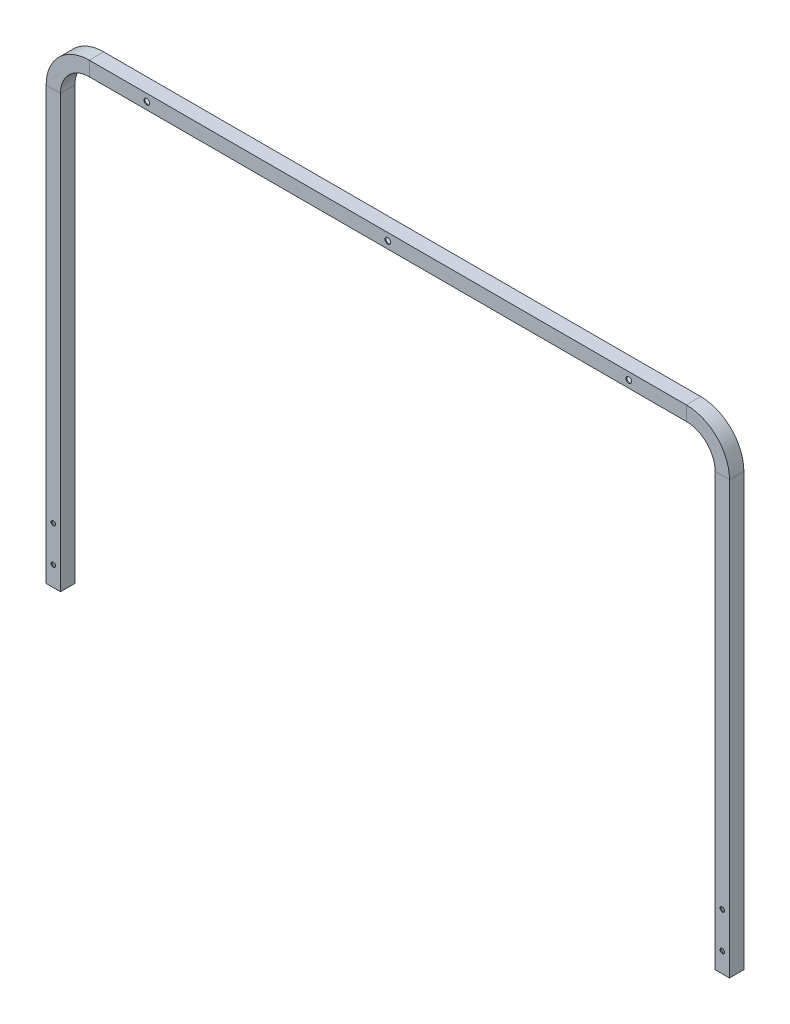
from build123d import *

# Parameters (mm, degrees)
SKETCH15_W                                    = 20
SKETCH15_H                                    = 20
SKETCH15_W_2                                  = 17.6
SKETCH15_H_2                                  = 17.6
AL_TUBE_SQUARE_AL_TUBE_0_75_SQR_X_0_065_DEPTH = 600
SKETCH15_ON_SEGMENT_2_W                       = 20
SKETCH15_ON_SEGMENT_2_H                       = 20
SKETCH15_ON_SEGMENT_2_W_2                     = 17.6
SKETCH15_ON_SEGMENT_2_H_2                     = 17.6
AL_TUBE_SQUARE_AL_TUBE_0_75_SQR_X_0_2_ANGLE   = 90
SKETCH15_ON_SEGMENT_3_W                       = 20
SKETCH15_ON_SEGMENT_3_H                       = 20
SKETCH15_ON_SEGMENT_3_W_2                     = 17.6
SKETCH15_ON_SEGMENT_3_H_2                     = 17.6
AL_TUBE_SQUARE_AL_TUBE_0_75_SQR_X_0_3_DEPTH   = 830
SKETCH15_ON_SEGMENT_4_W                       = 20
SKETCH15_ON_SEGMENT_4_H                       = 20
SKETCH15_ON_SEGMENT_4_W_2                     = 17.6
SKETCH15_ON_SEGMENT_4_H_2                     = 17.6
AL_TUBE_SQUARE_AL_TUBE_0_75_SQR_X_0_4_ANGLE   = 90
SKETCH15_ON_SEGMENT_5_W                       = 20
SKETCH15_ON_SEGMENT_5_H                       = 20
SKETCH15_ON_SEGMENT_5_W_2                     = 17.6
SKETCH15_ON_SEGMENT_5_H_2                     = 17.6
AL_TUBE_SQUARE_AL_TUBE_0_75_SQR_X_0_5_DEPTH   = 600
SKETCH16_R                                    = 4
CUT_EXTRUDE1_DEPTH                            = 1149.738438462
SKETCH17_R                                    = 3.125
CUT_EXTRUDE2_DEPTH                            = 1149.738438462


with BuildPart() as part:
    # Sketch15 → Al tube square AL TUBE 0.75 SQR X 0.065 WALL(1) (new body)
    with BuildSketch(Plane(origin=(0, 0, 0), x_dir=(-1, 0, 0), z_dir=(0, 1, 0))):
        Rectangle(SKETCH15_W, SKETCH15_H)
        Rectangle(SKETCH15_W_2, SKETCH15_H_2, mode=Mode.SUBTRACT)
    extrude(amount=AL_TUBE_SQUARE_AL_TUBE_0_75_SQR_X_0_065_DEPTH)


with BuildPart() as body_2:
    # Sketch15 on segment 2 (carried to the start of arc 2) → Al tube square AL TUBE 0.75 SQR X 0. 2 (revolve)
    with BuildSketch(Plane(origin=(0, 600, 0), x_dir=(-1, 0, 0), z_dir=(0, 1, 0))):
        Rectangle(SKETCH15_ON_SEGMENT_2_W, SKETCH15_ON_SEGMENT_2_H)
        Rectangle(SKETCH15_ON_SEGMENT_2_W_2, SKETCH15_ON_SEGMENT_2_H_2, mode=Mode.SUBTRACT)
    revolve(axis=Axis((50, 600, 0), (0, 0, -1)), revolution_arc=AL_TUBE_SQUARE_AL_TUBE_0_75_SQR_X_0_2_ANGLE)


with BuildPart() as body_3:
    # Sketch15 on segment 3 (carried to segment 3) → Al tube square AL TUBE 0.75 SQR X 0. 3 (new body)
    with BuildSketch(Plane(origin=(50, 650, 0), x_dir=(0, 1, 0), z_dir=(1, 0, 0))):
        Rectangle(SKETCH15_ON_SEGMENT_3_W, SKETCH15_ON_SEGMENT_3_H)
        Rectangle(SKETCH15_ON_SEGMENT_3_W_2, SKETCH15_ON_SEGMENT_3_H_2, mode=Mode.SUBTRACT)
    extrude(amount=AL_TUBE_SQUARE_AL_TUBE_0_75_SQR_X_0_3_DEPTH)

    # Sketch16 → Cut-Extrude1 (cut, through all)
    with BuildSketch(Plane.XY.offset(10)):
        with Locations((130, 650)):
            Circle(SKETCH16_R)
        with Locations((800, 650)):
            Circle(SKETCH16_R)
        with Locations((465, 650)):
            Circle(SKETCH16_R)
    extrude(amount=-CUT_EXTRUDE1_DEPTH, mode=Mode.SUBTRACT)


with BuildPart() as body_4:
    # Sketch15 on segment 4 (carried to the start of arc 4) → Al tube square AL TUBE 0.75 SQR X 0. 4 (revolve)
    with BuildSketch(Plane(origin=(930, 600, 0), x_dir=(-1, 0, 0), z_dir=(0, 1, 0))):
        Rectangle(SKETCH15_ON_SEGMENT_4_W, SKETCH15_ON_SEGMENT_4_H)
        Rectangle(SKETCH15_ON_SEGMENT_4_W_2, SKETCH15_ON_SEGMENT_4_H_2, mode=Mode.SUBTRACT)
    revolve(axis=Axis((880, 600, 0), (0, 0, 1)), revolution_arc=AL_TUBE_SQUARE_AL_TUBE_0_75_SQR_X_0_4_ANGLE)


with BuildPart() as body_5:
    # Sketch15 on segment 5 (carried to segment 5) → Al tube square AL TUBE 0.75 SQR X 0. 5 (new body)
    with BuildSketch(Plane(origin=(930, 0, 0), x_dir=(-1, 0, 0), z_dir=(0, 1, 0))):
        Rectangle(SKETCH15_ON_SEGMENT_5_W, SKETCH15_ON_SEGMENT_5_H)
        Rectangle(SKETCH15_ON_SEGMENT_5_W_2, SKETCH15_ON_SEGMENT_5_H_2, mode=Mode.SUBTRACT)
    extrude(amount=AL_TUBE_SQUARE_AL_TUBE_0_75_SQR_X_0_5_DEPTH)


with BuildPart() as cut_extrude2_tool:
    # Sketch17 → Cut-Extrude2 (new, through all)
    with BuildSketch(Plane(origin=(0, 0, -10), x_dir=(-1, 0, 0), z_dir=(0, 0, -1))):
        with Locations((-930, 27.5)):
            Circle(SKETCH17_R)
        with Locations((-930, 77.5)):
            Circle(SKETCH17_R)
        with Locations((0, 77.5)):
            Circle(SKETCH17_R)
        with Locations((0, 27.5)):
            Circle(SKETCH17_R)
    extrude(amount=-CUT_EXTRUDE2_DEPTH)


with BuildPart() as part_1:
    add(part.part)

    # Cut-Extrude2: cut by cut_extrude2_tool
    add(cut_extrude2_tool.part, mode=Mode.SUBTRACT)


with BuildPart() as body_5_1:
    add(body_5.part)

    # Cut-Extrude2: cut by cut_extrude2_tool
    add(cut_extrude2_tool.part, mode=Mode.SUBTRACT)


solid = Compound([body_2.part, body_3.part, body_4.part, part_1.part, body_5_1.part])
